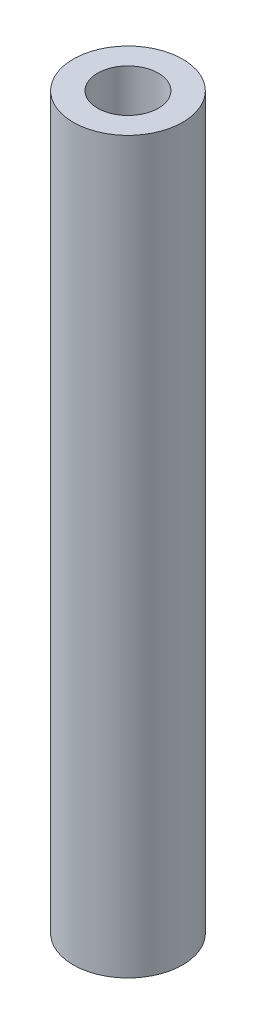
from build123d import *

# Parameters (mm, degrees)
SKETCH_1_R      = 2.25
SKETCH_1_R_2    = 1.25
EXTRUDE_1_DEPTH = 30


with BuildPart() as part:
    # 草图1 → 凸台-拉伸1 (new body)
    with BuildSketch(Plane(origin=(0, 0, 0), x_dir=(1, 0, 0), z_dir=(0, 1, 0))):
        with Locations(Location((0, 0, 0), (0, 0, 270))):
            Circle(SKETCH_1_R)
        with Locations(Location((0, 0, 0), (0, 0, 270))):
            Circle(SKETCH_1_R_2, mode=Mode.SUBTRACT)
    extrude(amount=EXTRUDE_1_DEPTH)


solid = part.part
